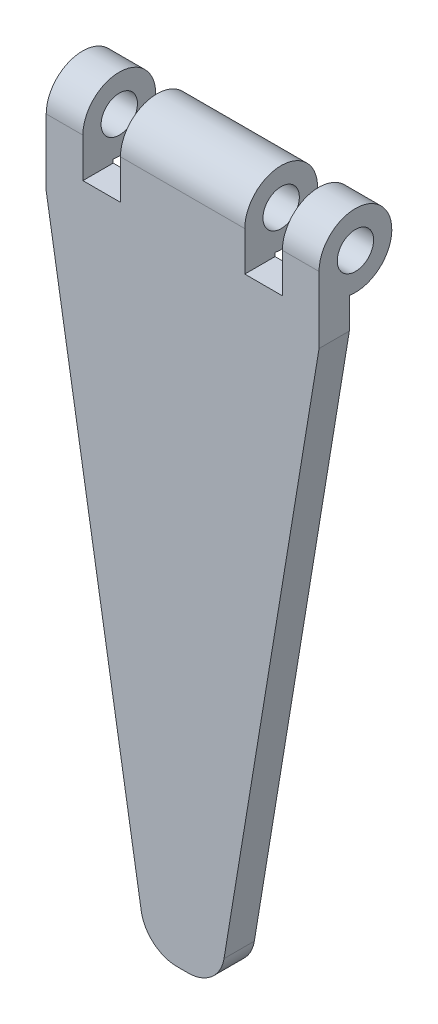
from build123d import *

# Parameters (mm, degrees)
CROQUIS1_W              = 45
CROQUIS1_H              = 17
SALIENTE_EXTRUIR1_DEPTH = 5
CROQUIS2_R              = 6
CROQUIS2_R_2            = 3
SALIENTE_EXTRUIR2_DEPTH = 45
CORTAR_EXTRUIR1_DEPTH   = 47.32763754
CROQUIS4_W              = 6.2
CROQUIS4_H              = 6.5
CROQUIS4_H_2            = 6
CORTAR_EXTRUIR2_DEPTH   = 27.879360111
SALIENTE_EXTRUIR3_DEPTH = 5
REDONDEO1_R             = 5.99


with BuildPart() as part:
    # Croquis1 → Saliente-Extruir1 (new body)
    with BuildSketch(Plane.XY):
        Rectangle(CROQUIS1_W, CROQUIS1_H)
    extrude(amount=SALIENTE_EXTRUIR1_DEPTH)

    # Croquis2 → Saliente-Extruir2 (add, through all)
    with BuildSketch(Plane(origin=(22.5, 0, 0), x_dir=(0, 0, -1), z_dir=(1, 0, 0))):
        with Locations((1, 2.5)):
            Circle(CROQUIS2_R)
        with Locations((1, 2.5)):
            Circle(CROQUIS2_R_2, mode=Mode.SUBTRACT)
    extrude(amount=-SALIENTE_EXTRUIR2_DEPTH)

    # Croquis3 → Cortar-Extruir1 (cut, through all)
    with BuildSketch(Plane(origin=(22.5, 0, 0), x_dir=(0, 0, -1), z_dir=(1, 0, 0))):
        with BuildLine():
            Line((-5, 8.5), (-5, 2.5))
            ThreePointArc((-5, 2.5), (-3.582575695, 6.372983346), (0, 8.416079783))
            Line((0, 8.416079783), (0, 8.5))
            Line((0, 8.5), (-5, 8.5))
        make_face()
        with BuildLine():
            ThreePointArc((0, -0.328427125), (2.732050808, 0.050510257), (4, 2.5))
            ThreePointArc((4, 2.5), (2.732050808, 4.949489743), (0, 5.328427125))
            Line((0, 5.328427125), (0, -0.328427125))
        make_face()
        with BuildLine():
            Line((0, -0.328427125), (0, 5.328427125))
            ThreePointArc((0, 5.328427125), (-2, 2.5), (0, -0.328427125))
        make_face()
    extrude(amount=-CORTAR_EXTRUIR1_DEPTH, mode=Mode.SUBTRACT)

    # Croquis4 → Cortar-Extruir2 (cut, through all)
    with BuildSketch(Plane.XY.offset(5)):
        with Locations((-13.35, -0.75)):
            Rectangle(CROQUIS4_W, CROQUIS4_H)
        with Locations((-13.35, 5.5)):
            Rectangle(CROQUIS4_W, CROQUIS4_H_2)
        with Locations((13.35, 5.5)):
            Rectangle(CROQUIS4_W, CROQUIS4_H_2)
        with Locations((13.35, -0.75)):
            Rectangle(CROQUIS4_W, CROQUIS4_H)
    extrude(amount=-CORTAR_EXTRUIR2_DEPTH, mode=Mode.SUBTRACT)

    # Croquis5 → Saliente-Extruir3 (add)
    with BuildSketch(Plane(origin=(0, 0, 0), x_dir=(-1, 0, 0), z_dir=(0, 0, -1))):
        Polygon((22.5, -8.5), (-22.5, -8.5), (-6, -108.5), (6, -108.5), align=None)
    extrude(amount=-SALIENTE_EXTRUIR3_DEPTH)

    # Redondeo1
    redondeo1_edges = [part.edges().sort_by_distance(p)[0] for p in [
        (6, -108.5, 2.5),
        (-6, -108.5, 2.5),
    ]]
    fillet(redondeo1_edges, radius=REDONDEO1_R)


solid = part.part
